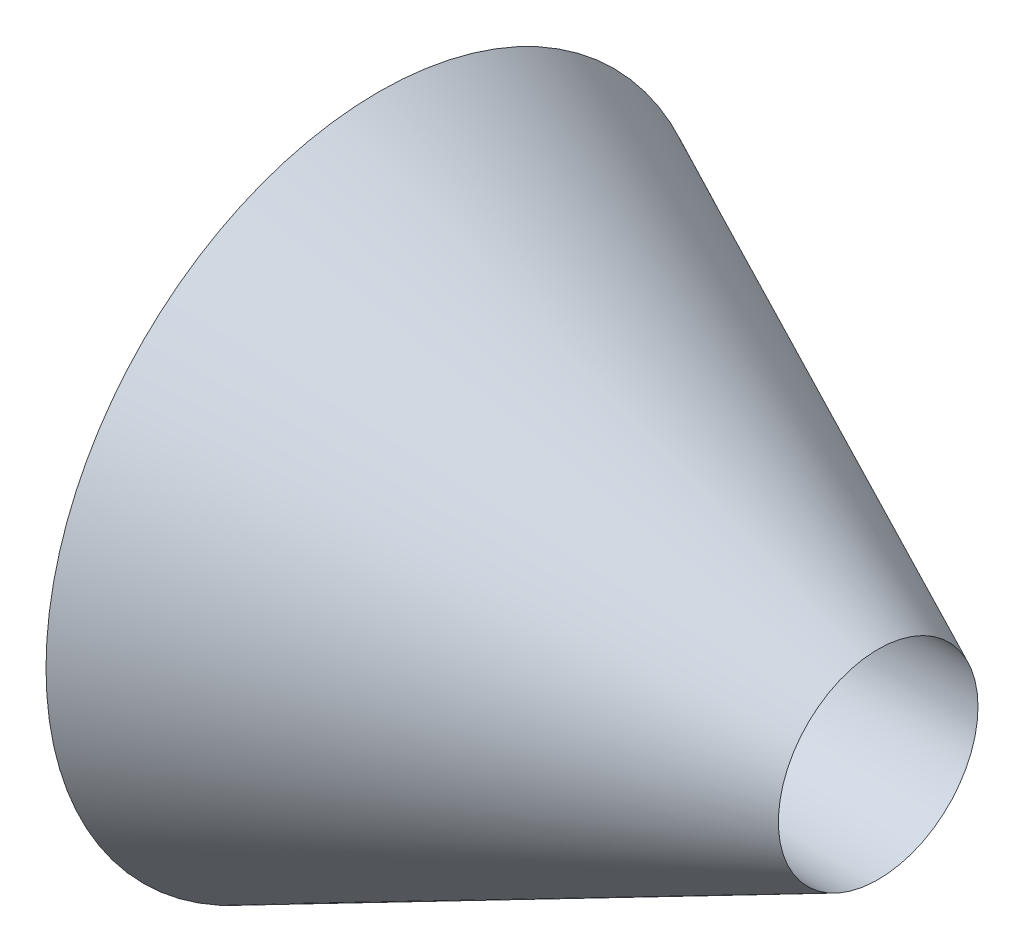
from build123d import *

# Parameters (mm, degrees)
SKETCH1_4_R        = 1.5
CUT_EXTRUDE1_DEPTH = 15


with BuildPart() as part:
    # Boss-Extrude1 cone 1 section (through the dimple's axis) → Boss-Extrude1 (revolve)
    with BuildSketch(Plane.ZX):
        Polygon((0, 0), (5, 0), (0, 10.722534603), align=None)
    revolve(axis=Axis((0, 0, 0), (1, 0, 0)))

    # Sketch1<4> → Cut-Extrude1 (cut)
    with BuildSketch(Plane(origin=(0, 0, 0), x_dir=(0, 0, -1), z_dir=(1, 0, 0))):
        Circle(SKETCH1_4_R)
    extrude(amount=CUT_EXTRUDE1_DEPTH, mode=Mode.SUBTRACT)


solid = part.part
